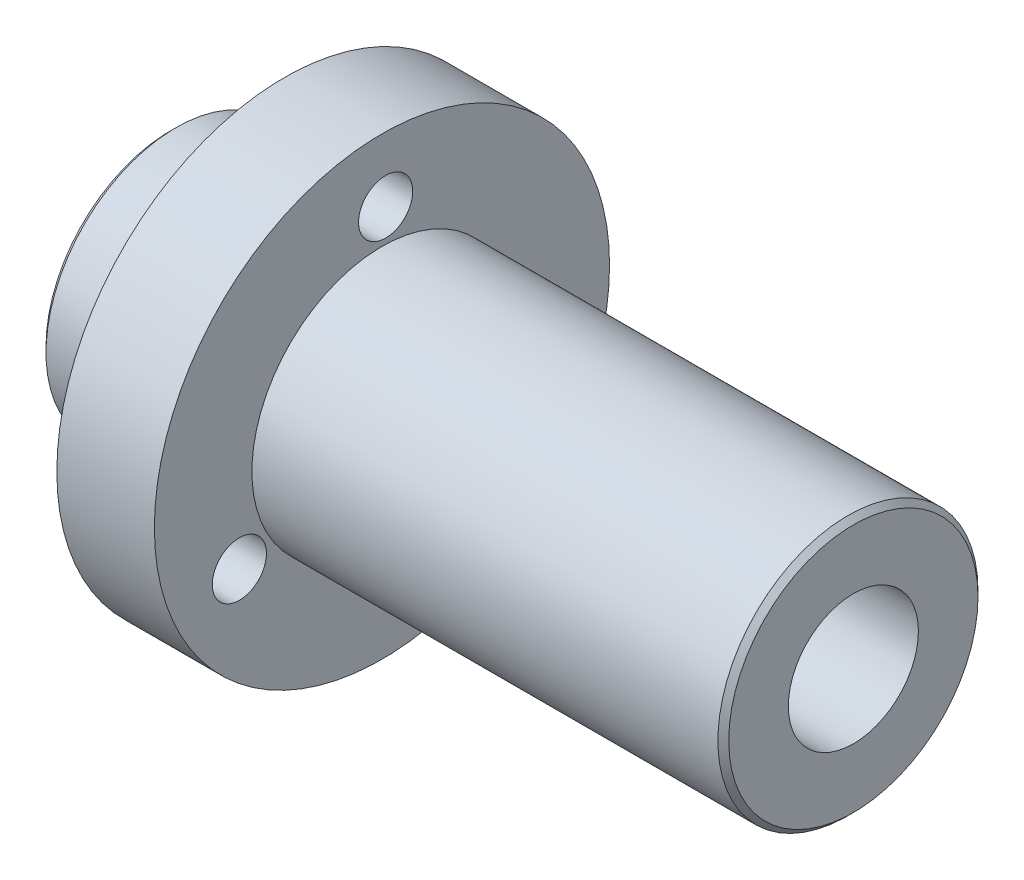
from build123d import *

# Parameters (mm, degrees)
ESQUISSE1_W                      = 18
ESQUISSE1_H                      = 42
ESQUISSE2_R                      = 24
EXTRUSION1_DEPTH                 = 21
EXTRUSION2_START                 = 87
ESQUISSE3_R                      = 24
EXTRUSION2_DEPTH                 = 87
DIAM_TRE_DU_PER_AGE_M10_0_10_1_D = 10
DIAM_TRE_DU_PER_AGE_M10_0_10_2_D = 10
DIAM_TRE_DU_PER_AGE_M10_0_10_3_D = 10
PER_AGE1_D                       = 24
PER_AGE1_CBORE_D                 = 36
PER_AGE1_CBORE_DEPTH             = 99
CHANFREIN1_SIZE                  = 1


with BuildPart() as part:
    # Esquisse1 → Révolution1 (revolve)
    with BuildSketch(Plane.XY, mode=Mode.PRIVATE) as r_volution1_sk:
        with Locations((30, 21)):
            Rectangle(ESQUISSE1_W, ESQUISSE1_H)
    revolve(r_volution1_sk.sketch.rotate(Axis((21, 0, 0), (1, 0, 0)), 270), axis=Axis((21, 0, 0), (1, 0, 0)))

    # Esquisse2 → Extrusion1 (add)
    with BuildSketch(Plane.ZY.offset(-21)):
        with Locations(Location((0, 0, 0), (0, 0, 180))):
            Circle(ESQUISSE2_R)
    extrude(amount=EXTRUSION1_DEPTH)

    # Esquisse3 → Extrusion2 (add)
    with BuildSketch(Plane(origin=(39, 0, 0), x_dir=(0, 0, -1), z_dir=(1, 0, 0)).offset(EXTRUSION2_START)):
        Circle(ESQUISSE3_R)
    extrude(amount=-EXTRUSION2_DEPTH)

    # Diamètre du perçage M10.0 (10)1 (through all)
    with Locations(Plane(origin=(39, 0, 0), x_dir=(0, 0, -1), z_dir=(1, 0, 0))):
        with Locations((25.633132295, -15.586613768)):
            Hole(DIAM_TRE_DU_PER_AGE_M10_0_10_1_D / 2)

    # Diamètre du perçage M10.0 (10)2 (through all)
    with Locations(Plane(origin=(39, 0, 0), x_dir=(0, 0, -1), z_dir=(1, 0, 0))):
        with Locations((0.681837335, 29.99225063)):
            Hole(DIAM_TRE_DU_PER_AGE_M10_0_10_2_D / 2)

    # Diamètre du perçage M10.0 (10)3 (through all)
    with Locations(Plane(origin=(39, 0, 0), x_dir=(0, 0, -1), z_dir=(1, 0, 0))):
        with Locations((-26.31496963, -14.405636862)):
            Hole(DIAM_TRE_DU_PER_AGE_M10_0_10_3_D / 2)

    # Perçage1 (through all)
    with Locations(Plane.ZY):
        with Locations((0, 0)):
            CounterBoreHole(PER_AGE1_D / 2, PER_AGE1_CBORE_D / 2, PER_AGE1_CBORE_DEPTH)

    # Chanfrein1
    chanfrein1_edges = [part.edges().sort_by_distance(p)[0] for p in [
        (126, 0, 24),
        (0, 0, 24),
    ]]
    chamfer(chanfrein1_edges, length=CHANFREIN1_SIZE)


solid = part.part
